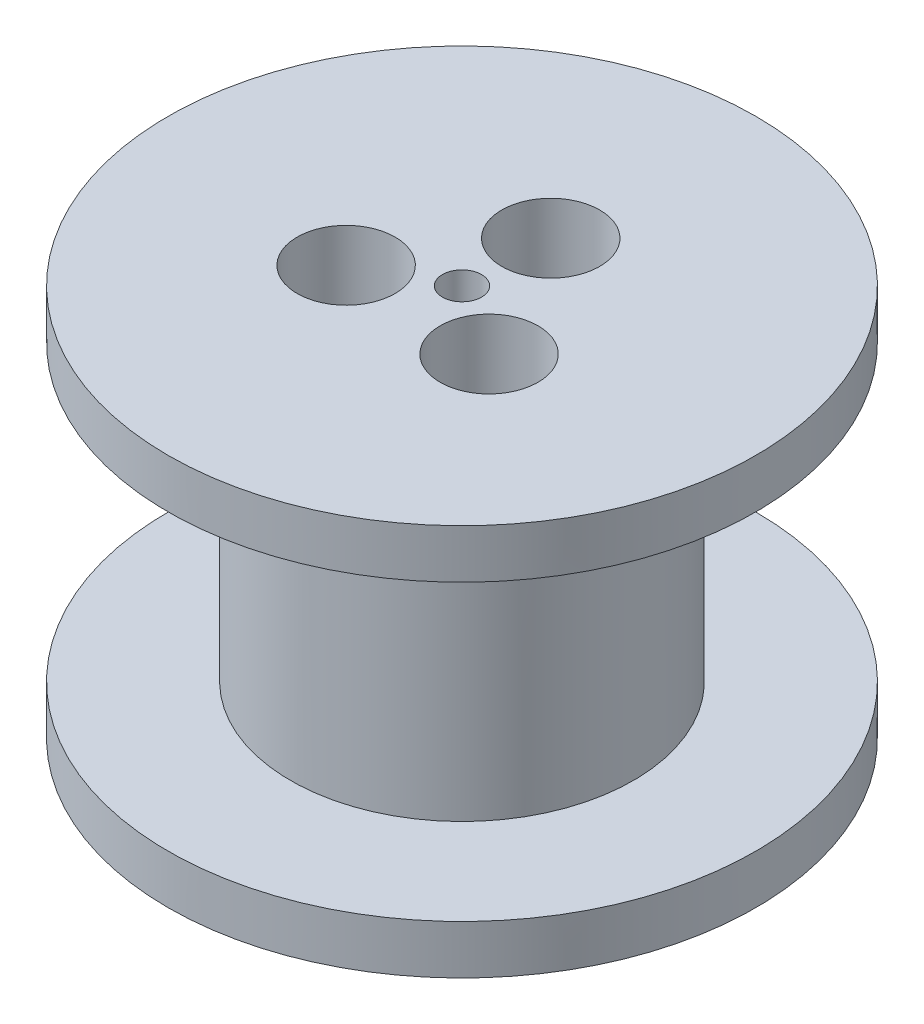
from build123d import *

# Parameters (mm, degrees)
SKETCH1_R           = 30
BOSS_EXTRUDE1_DEPTH = 40
CUT_EXTRUDE1_START  = -5
SKETCH2_OUTSIDE_W   = 80.762
SKETCH2_OUTSIDE_H   = 80.762
SKETCH2_OUTSIDE_R   = 17.5
CUT_EXTRUDE1_DEPTH  = 30
SKETCH3_R           = 2
CUT_EXTRUDE2_DEPTH  = 59.309518948
SKETCH4_R           = 5
CUT_EXTRUDE3_DEPTH  = 59.309518948
CUT_EXTRUDE4_REACH  = 57
SKETCH5_R           = 2


with BuildPart() as part:
    # Sketch1 → Boss-Extrude1 (new body)
    with BuildSketch(Plane(origin=(0, 0, 0), x_dir=(1, 0, 0), z_dir=(0, 1, 0))):
        Circle(SKETCH1_R)
    extrude(amount=BOSS_EXTRUDE1_DEPTH)

    # Sketch2 outside → Cut-Extrude1 (cut)
    with BuildSketch(Plane.XZ.offset(CUT_EXTRUDE1_START)):
        Rectangle(SKETCH2_OUTSIDE_W, SKETCH2_OUTSIDE_H)
        Circle(SKETCH2_OUTSIDE_R, mode=Mode.SUBTRACT)
    extrude(amount=-CUT_EXTRUDE1_DEPTH, mode=Mode.SUBTRACT)

    # Sketch3 → Cut-Extrude2 (cut, through all)
    with BuildSketch(Plane.XZ):
        Circle(SKETCH3_R)
    extrude(amount=-CUT_EXTRUDE2_DEPTH, mode=Mode.SUBTRACT)

    # Sketch4 → Cut-Extrude3 (cut, through all)
    with BuildSketch(Plane.XZ):
        with Locations((0.317902702, -8.744223114)):
            Circle(SKETCH4_R)
        with Locations((-7.731670704, 4.096799742)):
            Circle(SKETCH4_R)
        with Locations((7.413768003, 4.647423373)):
            Circle(SKETCH4_R)
    extrude(amount=-CUT_EXTRUDE3_DEPTH, mode=Mode.SUBTRACT)

    # Sketch5 → Cut-Extrude4 (cut, up to next)
    with BuildSketch(Plane(origin=(0, 5, 0), x_dir=(1, 0, 0), z_dir=(0, 1, 0)), mode=Mode.PRIVATE) as cut_extrude4_sk1:
        with Locations((-15.339737127, 8.422734999)):
            Circle(SKETCH5_R)
    cut_extrude4_tool1 = extrude(cut_extrude4_sk1.sketch, amount=-CUT_EXTRUDE4_REACH, mode=Mode.PRIVATE) & part.part
    add(cut_extrude4_tool1.solids().sort_by_distance((-15.339737, 5, -8.422735))[0], mode=Mode.SUBTRACT)


solid = part.part
